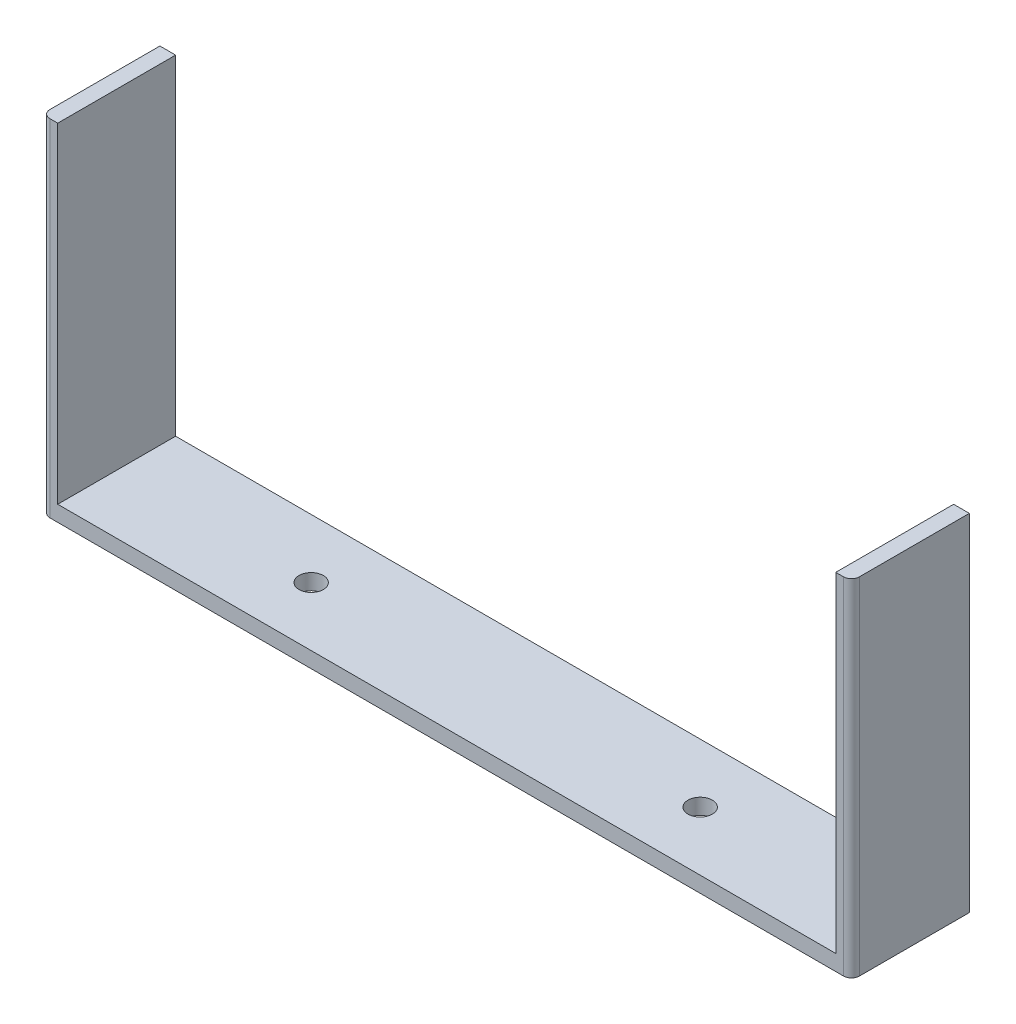
from build123d import *

# Parameters (mm, degrees)
ESBO_O1_W                = 103
ESBO_O1_H                = 15
RESSALTO_EXTRUS_O1_DEPTH = 2
ESBO_O2_W                = 2
ESBO_O2_H                = 15
RESSALTO_EXTRUS_O2_DEPTH = 42
ESBO_O4_R                = 1.55
CORTE_EXTRUS_O1_DEPTH    = 2
FILETE1_R                = 1


with BuildPart() as part:
    # Esboço1 → Ressalto-extrusão1 (new body)
    with BuildSketch(Plane(origin=(0, 0, 0), x_dir=(1, 0, 0), z_dir=(0, 1, 0))):
        Rectangle(ESBO_O1_W, ESBO_O1_H)
    extrude(amount=-RESSALTO_EXTRUS_O1_DEPTH)

    # Esboço2 → Ressalto-extrusão2 (add)
    with BuildSketch(Plane(origin=(0, 0, 0), x_dir=(1, 0, 0), z_dir=(0, 1, 0))):
        with Locations((-50.5, 0)):
            Rectangle(ESBO_O2_W, ESBO_O2_H)
        with Locations((50.5, 0)):
            Rectangle(ESBO_O2_W, ESBO_O2_H)
    extrude(amount=RESSALTO_EXTRUS_O2_DEPTH)

    # Esboço4 → Corte-extrusão1 (cut)
    with BuildSketch(Plane(origin=(0, 0, 0), x_dir=(1, 0, 0), z_dir=(0, 1, 0))):
        with Locations(Location((24.75, 0, 0), (0, 0, 270))):
            Circle(ESBO_O4_R)
        with Locations(Location((-24.75, 0, 0), (0, 0, 90))):
            Circle(ESBO_O4_R)
    extrude(amount=-CORTE_EXTRUS_O1_DEPTH, mode=Mode.SUBTRACT)

    # Filete1
    filete1_edges = [part.edges().sort_by_distance(p)[0] for p in [
        (51.5, 20, 7.5),
        (-51.5, 20, 7.5),
    ]]
    fillet(filete1_edges, radius=FILETE1_R)


solid = part.part
